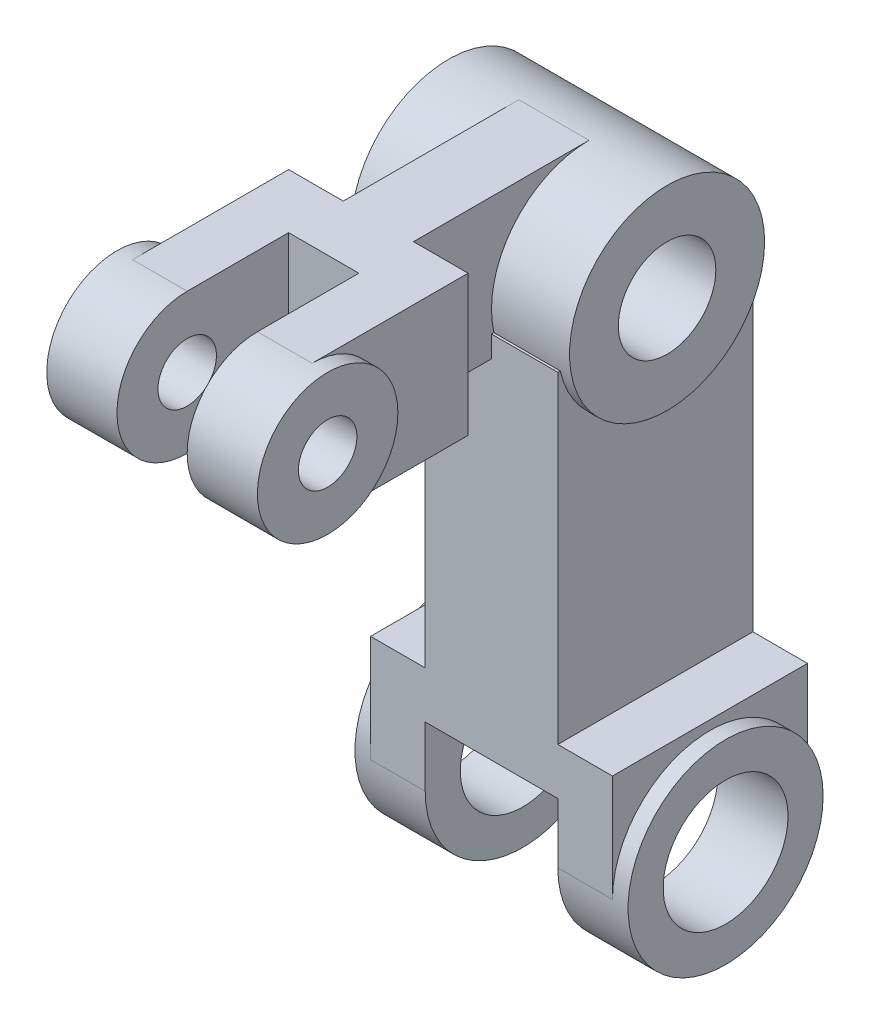
from build123d import *

# Parameters (mm, degrees)
BOSS_EXTRUDE1_DEPTH      = 25
SKETCH2_R                = 25
BOSS_EXTRUDE2_DEPTH      = 18
BOSS_EXTRUDE3_DEPTH      = 18
BOSS_EXTRUDE4_DEPTH      = 20
BOSS_EXTRUDE4_DEPTH_BACK = 36
SKETCH4_R                = 25
SKETCH5_R                = 18
BOSS_EXTRUDE5_DEPTH      = 18
BOSS_EXTRUDE6_START      = -18
SKETCH6_R                = 18
BOSS_EXTRUDE6_DEPTH      = 18
HOLE1_D                  = 32
HOLE2_D                  = 25
HOLE3_D                  = 15


with BuildPart() as part:
    # Sketch1 → Boss-Extrude1 (new, symmetric)
    with BuildSketch(Plane.XY):
        Polygon((-31, 0), (-17, 0), (-17, 15.39), (17, 15.39), (17, 0), (31, 0), (31, 27.39), (17, 27.39), (17, 110), (-17, 110), (-17, 27.39), (-31, 27.39), align=None)
    extrude(amount=BOSS_EXTRUDE1_DEPTH, both=True)

    # Sketch2 → Boss-Extrude2 (add)
    with BuildSketch(Plane(origin=(-17, 0, 0), x_dir=(0, 0, -1), z_dir=(1, 0, 0))):
        Circle(SKETCH2_R)
    boss_extrude2 = extrude(amount=-BOSS_EXTRUDE2_DEPTH)

    # Mirror1: Boss-Extrude2 across plane
    add(boss_extrude2.mirror(Plane(origin=(0, 0, 0), x_dir=(0, 0, 1), z_dir=(1, 0, 0))))

    # Sketch3 → Boss-Extrude3 (add, symmetric)
    with BuildSketch(Plane(origin=(0, 122.5, 0), x_dir=(1, 0, 0), z_dir=(0, 1, 0))):
        Polygon((-18, 0), (0, 0), (0, -45), (14, -45), (14, -85), (0, -85), (0, -59), (-18, -59), (-18, -85), (-32, -85), (-32, -45), (-18, -45), align=None)
    extrude(amount=BOSS_EXTRUDE3_DEPTH, both=True)

    # Sketch4 → Boss-Extrude4 (add, two sides: drawn at the far end of the back side and taken through both)
    with BuildSketch(Plane(origin=(0, 0, 0), x_dir=(0, 0, -1), z_dir=(1, 0, 0)).offset(-BOSS_EXTRUDE4_DEPTH_BACK)):
        with Locations((0, 115.5)):
            Circle(SKETCH4_R)
    extrude(amount=BOSS_EXTRUDE4_DEPTH + BOSS_EXTRUDE4_DEPTH_BACK)

    # Sketch5 → Boss-Extrude5 (add)
    with BuildSketch(Plane(origin=(0, 0, 0), x_dir=(0, 0, -1), z_dir=(1, 0, 0))):
        with Locations(Location((-85, 122.5, 0), (0, 0, 270))):
            Circle(SKETCH5_R)
    extrude(amount=BOSS_EXTRUDE5_DEPTH)

    # Sketch6 → Boss-Extrude6 (add)
    with BuildSketch(Plane(origin=(-18, 0, 0), x_dir=(0, 0, -1), z_dir=(1, 0, 0)).offset(BOSS_EXTRUDE6_START)):
        with Locations(Location((-85, 122.5, 0), (0, 0, 270))):
            Circle(SKETCH6_R)
    extrude(amount=BOSS_EXTRUDE6_DEPTH)

    # Hole1 (through all)
    with Locations(Plane(origin=(35, 0, 0), x_dir=(0, 0, -1), z_dir=(1, 0, 0))):
        with Locations((0, 0)):
            Hole(HOLE1_D / 2)

    # Hole2 (through all)
    with Locations(Plane(origin=(20, 0, 0), x_dir=(0, 0, -1), z_dir=(1, 0, 0))):
        with Locations((0, 115.5)):
            Hole(HOLE2_D / 2)

    # Hole3 (through all)
    with Locations(Plane(origin=(18, 0, 0), x_dir=(0, 0, -1), z_dir=(1, 0, 0))):
        with Locations((-85, 122.5)):
            Hole(HOLE3_D / 2)


solid = part.part
